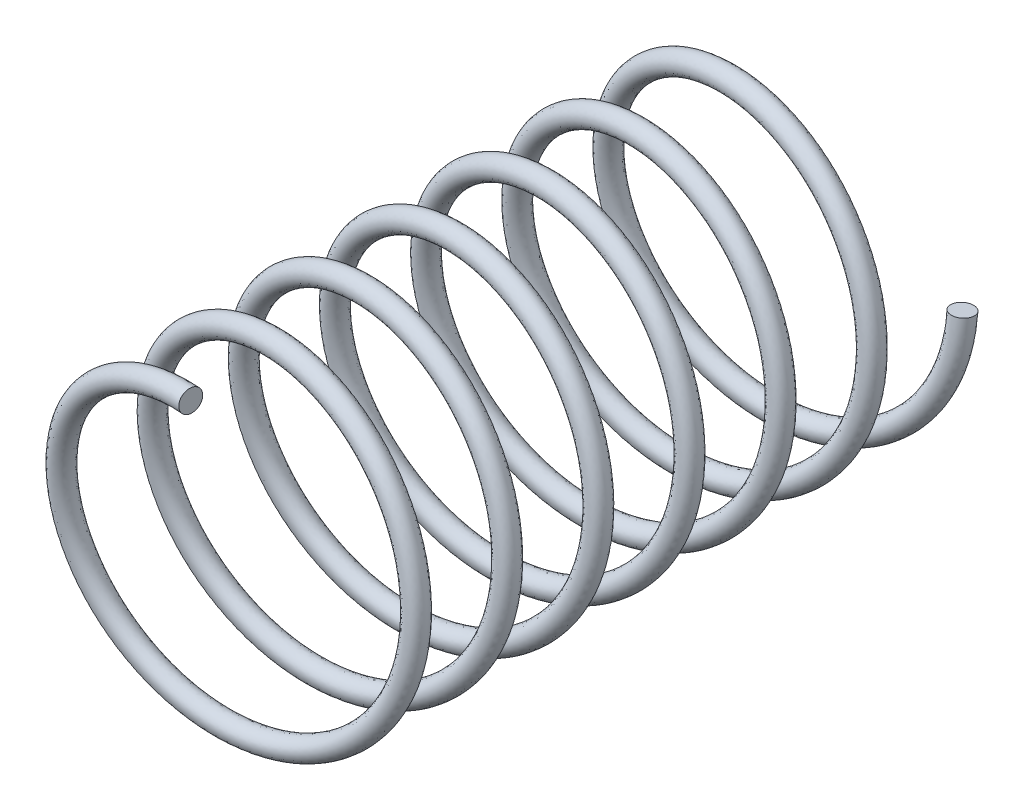
from build123d import *

# Parameters (mm, degrees)
SWEEP1_PITCH       = 4.148148148
SWEEP1_HEIGHT      = 28
SWEEP1_RADIUS      = 7
SWEEP1_START_ANGLE = 1
SWEEP1_PROFILE_R   = 0.5


with BuildPart() as part:
    # Sweep1: sweep along a helix
    with BuildLine() as sweep1_path:
        add(Helix(SWEEP1_PITCH, SWEEP1_HEIGHT, SWEEP1_RADIUS, center=(0, 0, 0), direction=(0, 0, 1), lefthand=True, mode=Mode.PRIVATE).rotate(Axis((0, 0, 0), (0, 0, 1)), SWEEP1_START_ANGLE))
    # Sweep1 profile (on start of the path) → Sweep1 (sweep)
    with BuildSketch(Plane(origin=(6.998933866, 0.122166845, 0), x_dir=(0, -0.09391152704008714, -0.9955805467610338), z_dir=(0.01737529968022496, -0.9954302520159161, 0.09389734997619609))):
        Circle(SWEEP1_PROFILE_R)
    sweep(path=sweep1_path.line, is_frenet=True)


solid = part.part
